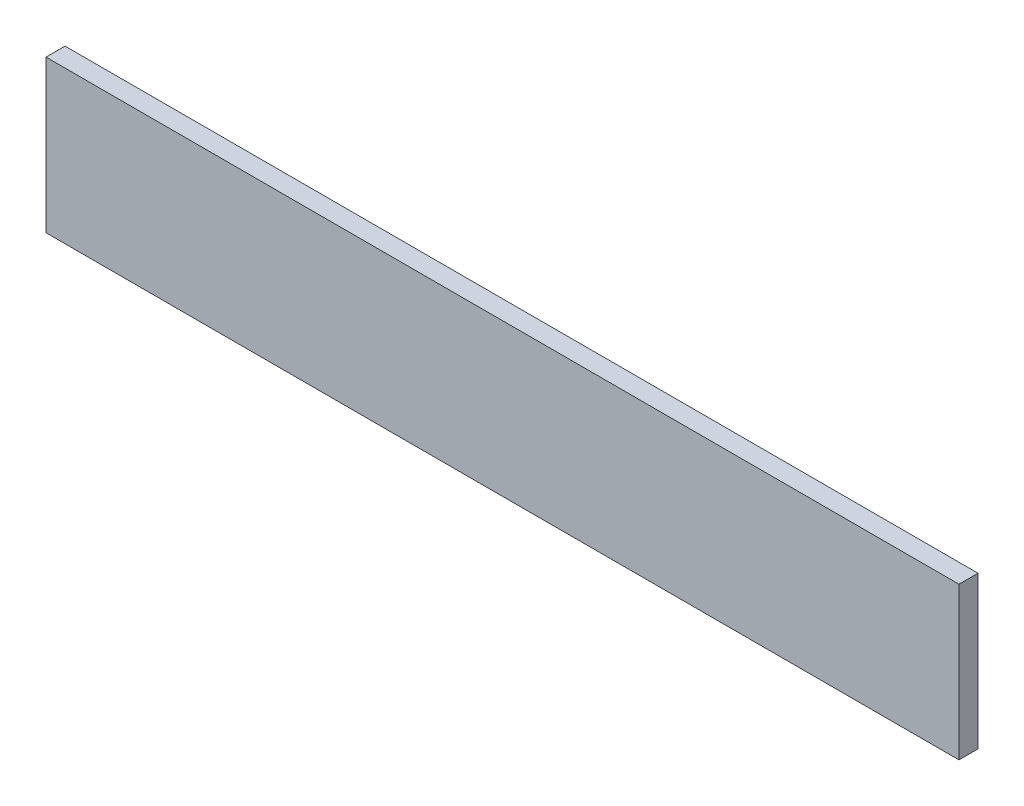
from build123d import *

# Parameters (mm, degrees)
SKETCH1_W           = 480
SKETCH1_H           = 80
BOSS_EXTRUDE1_DEPTH = 10


with BuildPart() as part:
    # Sketch1 → Boss-Extrude1 (new body)
    with BuildSketch(Plane.XY):
        Rectangle(SKETCH1_W, SKETCH1_H)
    extrude(amount=BOSS_EXTRUDE1_DEPTH)


solid = part.part
